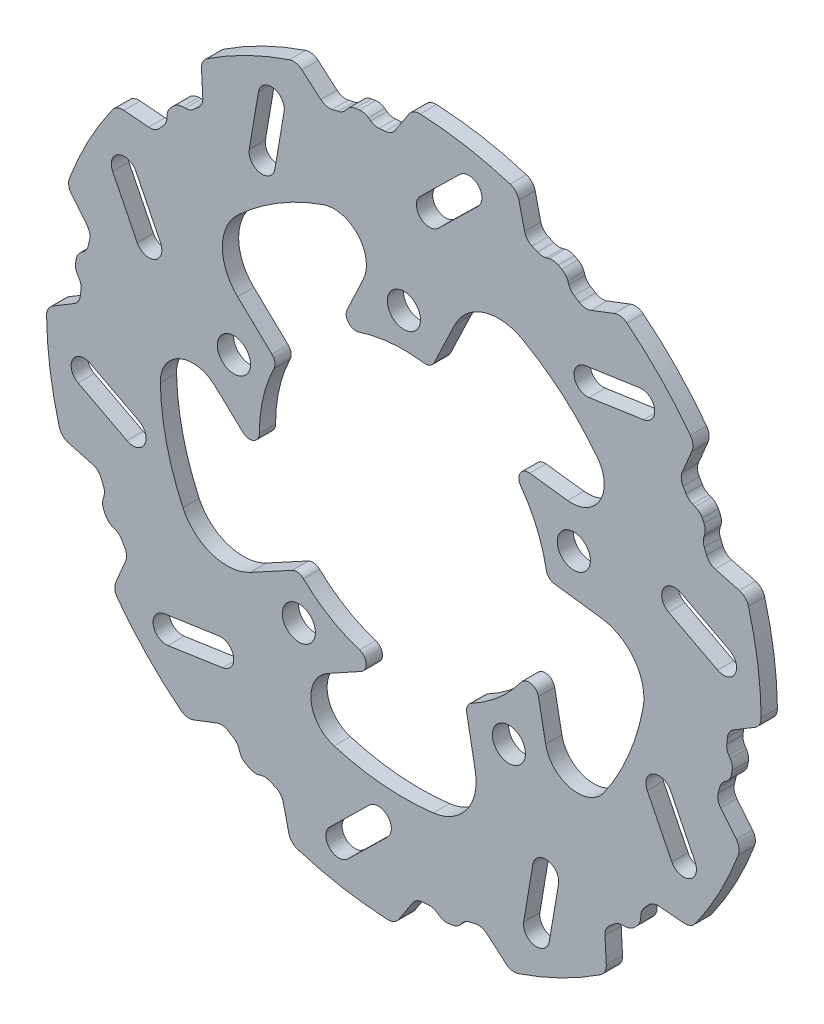
from build123d import *

# Parameters (mm, degrees)
SKETCH1_R                = 110
SKETCH1_R_2              = 44.5
EXTRUDE1_DEPTH           = 2.5
SKETCH3_R                = 5.1
EXTRUDE4_DEPTH           = 156.643824163
CUT_EXTRUDE2_DEPTH       = 156.643824163
FILLET2_R                = 3
CIRPATTERN1_COUNT        = 5
FILLET2_OF_CIRPATTERN1_R = 3
CUT_EXTRUDE3_DEPTH       = 156.643824163
FILLET1_R                = 4
CIRPATTERN2_COUNT        = 10
FILLET1_OF_CIRPATTERN2_R = 4


with BuildPart() as part:
    # Sketch1 → Extrude1 (new, symmetric)
    with BuildSketch(Plane.XY):
        Circle(SKETCH1_R)
        Circle(SKETCH1_R_2, mode=Mode.SUBTRACT)
    extrude(amount=EXTRUDE1_DEPTH, both=True)

    # Sketch3 → Extrude4 (cut, through all)
    with BuildSketch(Plane.XY.offset(2.5)):
        with Locations((0, 55)):
            Circle(SKETCH3_R)
        with Locations((52.308108396, 16.995934691)):
            Circle(SKETCH3_R)
        with Locations((32.328188876, -44.495934691)):
            Circle(SKETCH3_R)
        with Locations((-32.328188876, -44.495934691)):
            Circle(SKETCH3_R)
        with Locations((-52.308108396, 16.995934691)):
            Circle(SKETCH3_R)
    extrude(amount=-EXTRUDE4_DEPTH, mode=Mode.SUBTRACT)

    # Sketch5 → Cut-Extrude2 (cut, through all)
    with BuildSketch(Plane.XY.offset(2.5)):
        with BuildLine():
            Line((-38.983455372, 21.46020054), (-51.193803029, 33.056695829))
            ThreePointArc((-51.193803029, 33.056695829), (-55.86391994, 44.011155078), (-51.080153326, 54.916463253))
            ThreePointArc((-51.080153326, 54.916463253), (-38.784403982, 64.193224002), (-24.852857816, 70.762528632))
            ThreePointArc((-24.852857816, 70.762528632), (-14.121925684, 68.03460173), (-12.484093803, 57.084168116))
            Line((-12.484093803, 57.084168116), (-20.799305867, 39.34004163))
            ThreePointArc((-20.799305867, 39.34004163), (-31.199628439, 31.730634808), (-38.983455372, 21.46020054))
        make_face()
    cut_extrude2 = extrude(amount=-CUT_EXTRUDE2_DEPTH, mode=Mode.SUBTRACT)

    # Fillet2
    fillet2_edges = [part.edges().sort_by_distance(p)[0] for p in [
        (-20.799305867, 39.34004163, 0),
        (-38.983455372, 21.46020054, 0),
    ]]
    fillet(fillet2_edges, radius=FILLET2_R)

    # CirPattern1: Cut-Extrude2 ×5 about axis
    cirpattern1_axis = Axis((0, 0, 0), (0, 0, 1))
    for i in range(1, CIRPATTERN1_COUNT):
        add(cut_extrude2.rotate(cirpattern1_axis, i * 360 / CIRPATTERN1_COUNT), mode=Mode.SUBTRACT)

    # Fillet2 of CirPattern1
    fillet2_of_cirpattern1_edges = [part.edges().sort_by_distance(p)[0] for p in [
        (-43.841941928, -7.624573956, 0),
        (-32.456413774, -30.44390259, 0),
        (-6.296504377, -44.052287485, 0),
        (18.924288507, -40.275567091, 0),
        (39.950488212, -19.601236991, 0),
        (44.152267285, 5.552233212, 0),
        (30.987263959, 31.938056802, 0),
        (8.363313355, 43.707035929, 0),
    ]]
    fillet(fillet2_of_cirpattern1_edges, radius=FILLET2_OF_CIRPATTERN1_R)

    # Sketch6 → Cut-Extrude3 (cut, through all)
    with BuildSketch(Plane.XY.offset(2.5)):
        with BuildLine():
            Line((-36.872065924, 89.564094112), (-39.710678737, 72.80276131))
            ThreePointArc((-39.710678737, 72.80276131), (-44.322430646, 69.526827195), (-47.598364761, 74.138579104))
            Line((-47.598364761, 74.138579104), (-44.759751948, 90.899911906))
            ThreePointArc((-44.759751948, 90.899911906), (-40.148000039, 94.175846021), (-36.872065924, 89.564094112))
        make_face()
        with BuildLine():
            Line((-62.419719966, 90.574712582), (-61.800885462, 78.617113633))
            ThreePointArc((-61.800885462, 78.617113633), (-63.844171176, 76.967017656), (-65.843418245, 75.263831113))
            Line((-65.843418245, 75.263831113), (-69.661846668, 75.189607785))
            ThreePointArc((-69.661846668, 75.189607785), (-71.250563968, 73.685867941), (-72.806828947, 72.148566574))
            Line((-72.806828947, 72.148566574), (-73.009292951, 68.334787208))
            ThreePointArc((-73.009292951, 68.334787208), (-74.778684056, 66.393888355), (-76.496494072, 64.407192104))
            Line((-76.496494072, 64.407192104), (-88.426552893, 65.427400556))
            ThreePointArc((-88.426552893, 65.427400556), (-76.464019868, 79.077516815), (-62.419719966, 90.574712582))
        make_face()
    cut_extrude3 = extrude(amount=-CUT_EXTRUDE3_DEPTH, mode=Mode.SUBTRACT)

    # Fillet1
    fillet1_edges = [part.edges().sort_by_distance(p)[0] for p in [
        (-88.426552893, 65.427400556, 0),
        (-62.419719966, 90.574712582, 0),
        (-61.800885462, 78.617113633, 0),
        (-65.843418245, 75.263831113, 0),
        (-69.661846668, 75.189607785, 0),
        (-72.806828947, 72.148566574, 0),
        (-73.009292951, 68.334787208, 0),
        (-76.496494072, 64.407192104, 0),
    ]]
    fillet(fillet1_edges, radius=FILLET1_R)

    # CirPattern2: Cut-Extrude3 ×10 about axis
    cirpattern2_axis = Axis((0, 0, 0), (0, 0, 1))
    for i in range(1, CIRPATTERN2_COUNT):
        add(cut_extrude3.rotate(cirpattern2_axis, i * 360 / CIRPATTERN2_COUNT), mode=Mode.SUBTRACT)

    # Fillet1 of CirPattern2
    fillet1_of_cirpattern2_edges = [part.edges().sort_by_distance(p)[0] for p in [
        (-109.995845187, 0.956055246, 0),
        (-103.737094523, 36.587090891, 0),
        (-96.207946578, 27.276931925, 0),
        (-97.507414287, 22.187928227, 0),
        (-100.552960395, 19.883464379, 0),
        (-101.309825331, 15.574636157, 0),
        (-99.231938884, 12.370218482, 0),
        (-99.744561375, 7.143001904, 0),
        (-89.550463241, -63.880470673, 0),
        (-105.430424867, -31.375555971, 0),
        (-93.866842089, -34.48211067, 0),
        (-91.926892227, -39.363009102, 0),
        (-93.036260921, -43.017486605, 0),
        (-91.115911833, -46.94827591, 0),
        (-87.551356933, -48.319353257, 0),
        (-84.893596425, -52.849572241, 0),
        (-34.899848045, -104.316828012, 0),
        (-66.852916359, -87.353806868, 0),
        (-55.671794338, -83.070158993, 0),
        (-51.233421816, -85.878614853, 0),
        (-49.982871961, -89.487219817, 0),
        (-46.11881693, -91.538542292, 0),
        (-42.429132395, -90.552574365, 0),
        (-37.616163068, -92.655406081, 0),
        (33.081322902, -104.907702649, 0),
        (-2.73986605, -109.965872588, 0),
        (3.787986635, -99.928230032, 0),
        (9.029474369, -99.591508637, 0),
        (12.162275232, -101.775876617, 0),
        (16.494098519, -101.164196799, 0),
        (18.899578605, -98.197789835, 0),
        (24.029366054, -97.07002404, 0),
        (88.426552893, -65.427400556, 0),
        (62.419719966, -90.574712582, 0),
        (61.800885462, -78.617113633, 0),
        (65.843418245, -75.263831113, 0),
        (69.661846668, -75.189607785, 0),
        (72.806828947, -72.148566574, 0),
        (73.009292951, -68.334787208, 0),
        (76.496494072, -64.407192104, 0),
        (109.995845187, -0.956055246, 0),
        (103.737094523, -36.587090891, 0),
        (96.207946578, -27.276931925, 0),
        (97.507414287, -22.187928227, 0),
        (100.552960395, -19.883464379, 0),
        (101.309825331, -15.574636157, 0),
        (99.231938884, -12.370218482, 0),
        (99.744561375, -7.143001904, 0),
        (89.550463241, 63.880470673, 0),
        (105.430424867, 31.375555971, 0),
        (93.866842089, 34.48211067, 0),
        (91.926892227, 39.363009102, 0),
        (93.036260921, 43.017486605, 0),
        (91.115911833, 46.94827591, 0),
        (87.551356933, 48.319353257, 0),
        (84.893596425, 52.849572241, 0),
        (34.899848045, 104.316828012, 0),
        (66.852916359, 87.353806868, 0),
        (55.671794338, 83.070158993, 0),
        (51.233421816, 85.878614853, 0),
        (49.982871961, 89.487219817, 0),
        (46.11881693, 91.538542292, 0),
        (42.429132395, 90.552574365, 0),
        (37.616163068, 92.655406081, 0),
        (-33.081322902, 104.907702649, 0),
        (2.73986605, 109.965872588, 0),
        (-3.787986635, 99.928230032, 0),
        (-9.029474369, 99.591508637, 0),
        (-12.162275232, 101.775876617, 0),
        (-16.494098519, 101.164196799, 0),
        (-18.899578605, 98.197789835, 0),
        (-24.029366054, 97.07002404, 0),
    ]]
    fillet(fillet1_of_cirpattern2_edges, radius=FILLET1_OF_CIRPATTERN2_R)


solid = part.part
